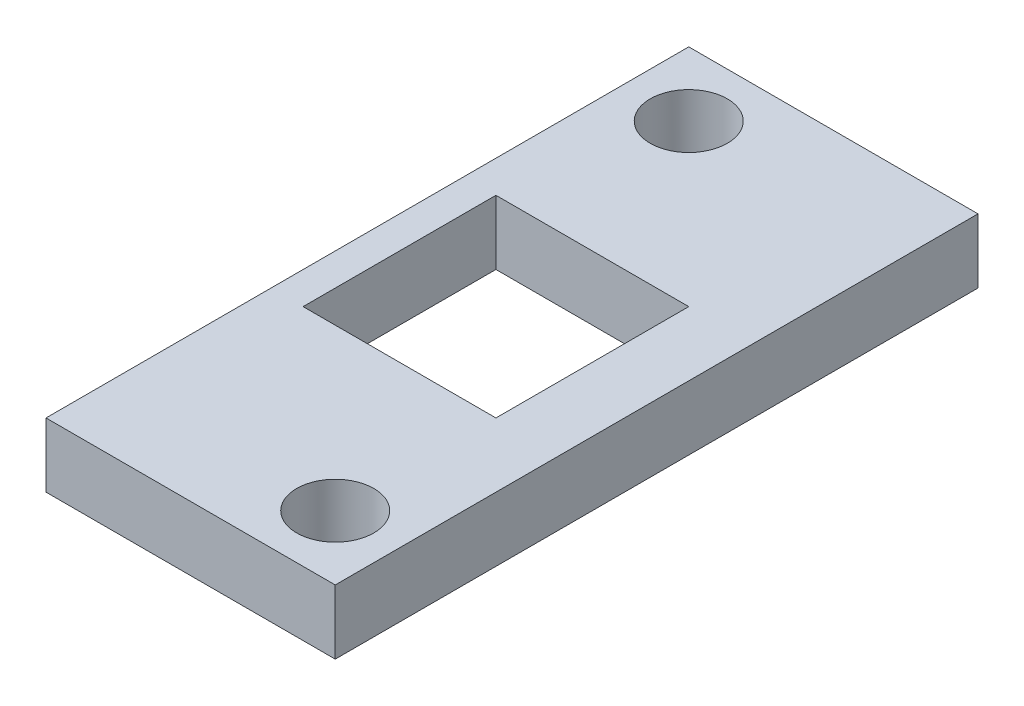
from build123d import *

# Parameters (mm, degrees)
SKETCH_1_W              = 9
SKETCH_1_H              = 2
CARRIER_1_DEPTH         = 20
SKETCH_2_W              = 6
SKETCH_2_H              = 6
TACT_6X6_POCKET_2_DEPTH = 4
SKETCH_3_R              = 1.2
CARRIER_M2_3_DEPTH      = 4


with BuildPart() as part:
    # Эскиз1 → Carrier_1 (new body)
    with BuildSketch(Plane.XY.offset(67)):
        with Locations((38.5, -55)):
            Rectangle(SKETCH_1_W, SKETCH_1_H)
    extrude(amount=CARRIER_1_DEPTH)

    # Эскиз2 → Tact_6x6_pocket_2 (cut)
    with BuildSketch(Plane(origin=(0, -57, 0), x_dir=(1, 0, 0), z_dir=(0, 1, 0))):
        with Locations((38, -77)):
            Rectangle(SKETCH_2_W, SKETCH_2_H)
    extrude(amount=TACT_6X6_POCKET_2_DEPTH, mode=Mode.SUBTRACT)

    # Эскиз3 → Carrier_M2_3 (cut)
    with BuildSketch(Plane(origin=(0, -57, 0), x_dir=(1, 0, 0), z_dir=(0, 1, 0))):
        with Locations(Location((36, -69, 0), (0, 0, 90))):
            Circle(SKETCH_3_R)
        with Locations(Location((41, -85, 0), (0, 0, 90))):
            Circle(SKETCH_3_R)
    extrude(amount=CARRIER_M2_3_DEPTH, mode=Mode.SUBTRACT)


solid = part.part
